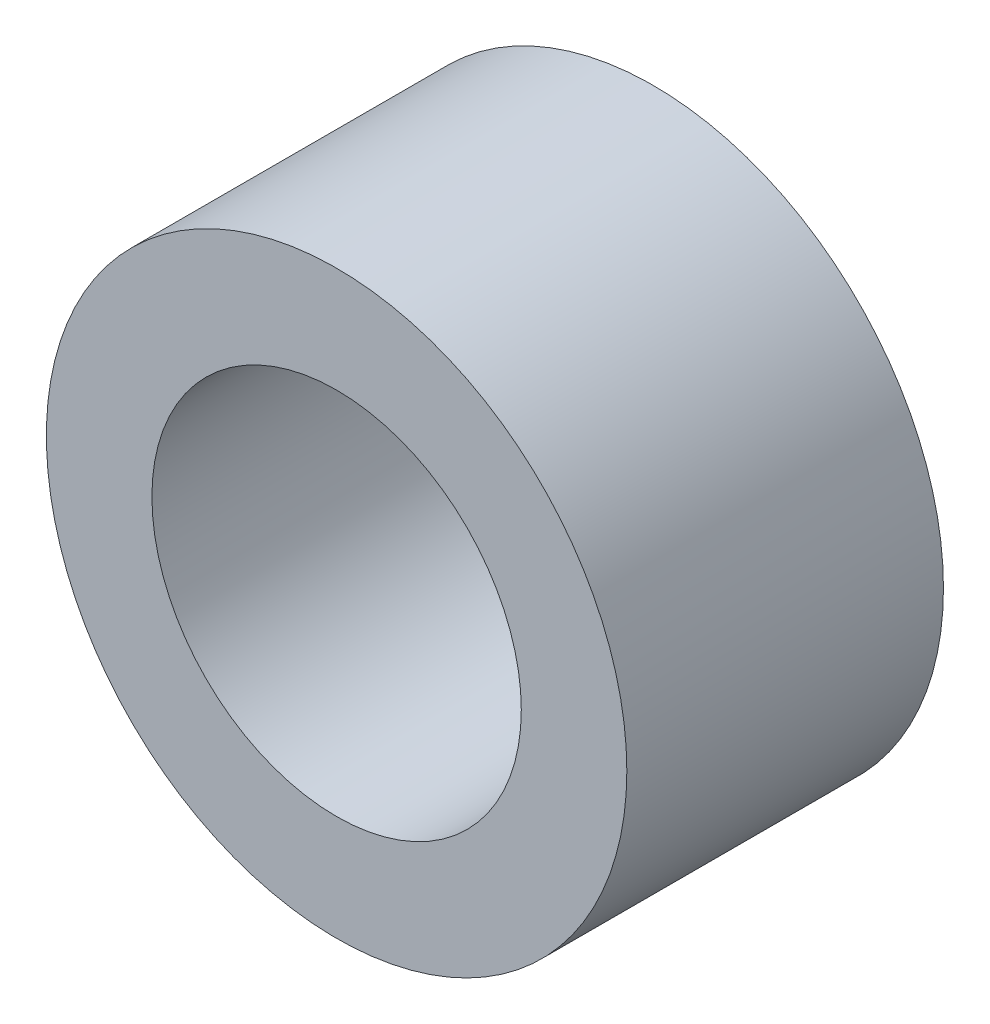
from build123d import *

# Parameters (mm, degrees)
SKETCH_1_R      = 2.75
SKETCH_1_R_2    = 1.75
EXTRUDE_1_DEPTH = 3


with BuildPart() as part:
    # 草图1 → 凸台-拉伸1 (new body)
    with BuildSketch(Plane.XY):
        Circle(SKETCH_1_R)
        Circle(SKETCH_1_R_2, mode=Mode.SUBTRACT)
    extrude(amount=EXTRUDE_1_DEPTH)


solid = part.part
